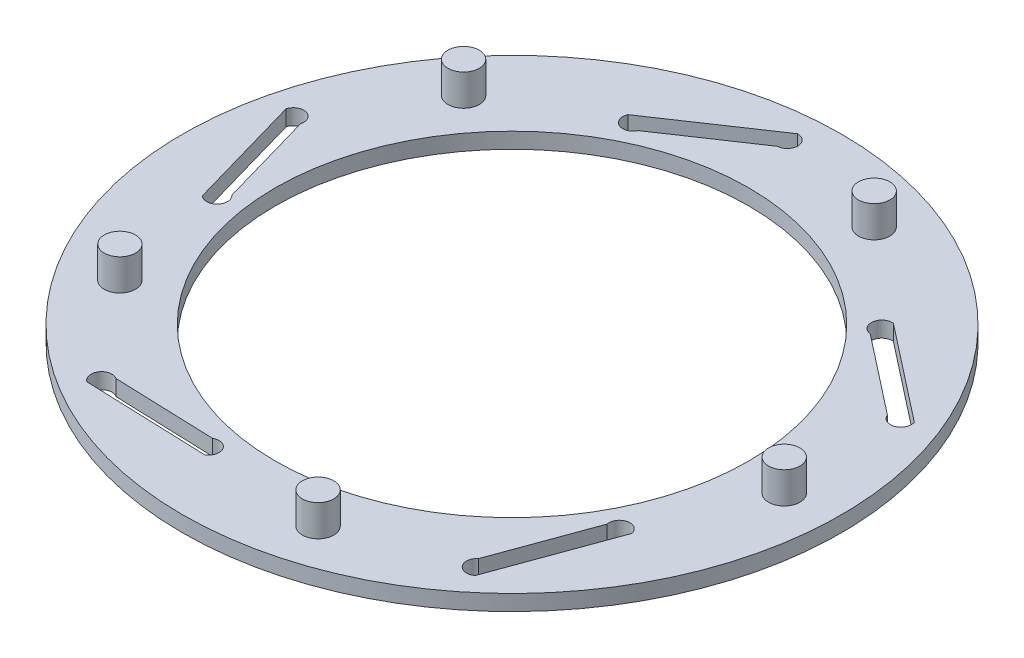
from build123d import *

# Parameters (mm, degrees)
SKETCH1_R           = 31.5
SKETCH1_R_2         = 22.625
BOSS_EXTRUDE1_DEPTH = 1.5
SKETCH2_R           = 1.5
BOSS_EXTRUDE2_DEPTH = 3


with BuildPart() as part:
    # Sketch1 → Boss-Extrude1 (new body)
    with BuildSketch(Plane(origin=(0, 0, 0), x_dir=(1, 0, 0), z_dir=(0, 1, 0))):
        with Locations(Location((0, 0, 0), (0, 0, 270))):
            Circle(SKETCH1_R)
        with Locations(Location((0, 0, 0), (0, 0, 270))):
            Circle(SKETCH1_R_2, mode=Mode.SUBTRACT)
        with BuildLine():
            Line((25.445602695, 10.437123544), (17.907280569, 16.334544855))
            ThreePointArc((17.907280569, 16.334544855), (17.026861096, 17.44127949), (18.13359573, 18.321698963))
            Line((18.13359573, 18.321698963), (27.319881621, 11.135033644))
            ThreePointArc((27.319881621, 11.135033644), (26.731697208, 9.848939131), (25.445602695, 10.437123544))
        make_face(mode=Mode.SUBTRACT)
        with BuildLine():
            Line((-11.821381939, 22.907790728), (-2.147738601, 29.423666069))
            ThreePointArc((-2.147738601, 29.423666069), (-1.106349013, 28.466844389), (-2.063170693, 27.425454801))
            Line((-2.063170693, 27.425454801), (-10.001421306, 22.07848783))
            ThreePointArc((-10.001421306, 22.07848783), (-11.326053072, 21.583158963), (-11.821381939, 22.907790728))
        make_face(mode=Mode.SUBTRACT)
        with BuildLine():
            Line((17.789418023, -20.974957706), (21.068729344, -11.983183919))
            ThreePointArc((21.068729344, -11.983183919), (21.849231951, -10.803855431), (23.028560438, -11.584358037))
            Line((23.028560438, -11.584358037), (19.032354011, -22.541836811))
            ThreePointArc((19.032354011, -22.541836811), (17.627446465, -22.379865253), (17.789418023, -20.974957706))
        make_face(mode=Mode.SUBTRACT)
        with BuildLine():
            Line((-14.451137717, -23.400360319), (-4.886089735, -23.74055981))
            ThreePointArc((-4.886089735, -23.74055981), (-3.523293122, -24.118429356), (-3.901162667, -25.481225968))
            Line((-3.901162667, -25.481225968), (-15.557239956, -25.066654962))
            ThreePointArc((-15.557239956, -25.066654962), (-15.837336158, -23.680456521), (-14.451137717, -23.400360319))
        make_face(mode=Mode.SUBTRACT)
        with BuildLine():
            Line((-26.720712308, 6.51273968), (-24.088498872, -2.689288956))
            ThreePointArc((-24.088498872, -2.689288956), (-24.026746852, -4.102153666), (-25.439611562, -4.163905686))
            Line((-25.439611562, -4.163905686), (-28.647257075, 7.04979206))
            ThreePointArc((-28.647257075, 7.04979206), (-27.415458501, 7.744538254), (-26.720712308, 6.51273968))
        make_face(mode=Mode.SUBTRACT)
    extrude(amount=BOSS_EXTRUDE1_DEPTH)

    # Sketch2 → Boss-Extrude2 (add)
    with BuildSketch(Plane(origin=(0, 1.5, 0), x_dir=(1, 0, 0), z_dir=(0, 1, 0))):
        with Locations(Location((-21.264622422, 16.637783303, 0), (0, 0, 270))):
            Circle(SKETCH2_R)
        with Locations(Location((9.252342519, 25.365215511, 0), (0, 0, 270))):
            Circle(SKETCH2_R)
        with Locations(Location((26.982884575, -0.961217985, 0), (0, 0, 270))):
            Circle(SKETCH2_R)
        with Locations(Location((7.423997262, -25.959280896, 0), (0, 0, 270))):
            Circle(SKETCH2_R)
        with Locations(Location((-22.394601934, -15.082499932, 0), (0, 0, 270))):
            Circle(SKETCH2_R)
    extrude(amount=BOSS_EXTRUDE2_DEPTH)


solid = part.part
